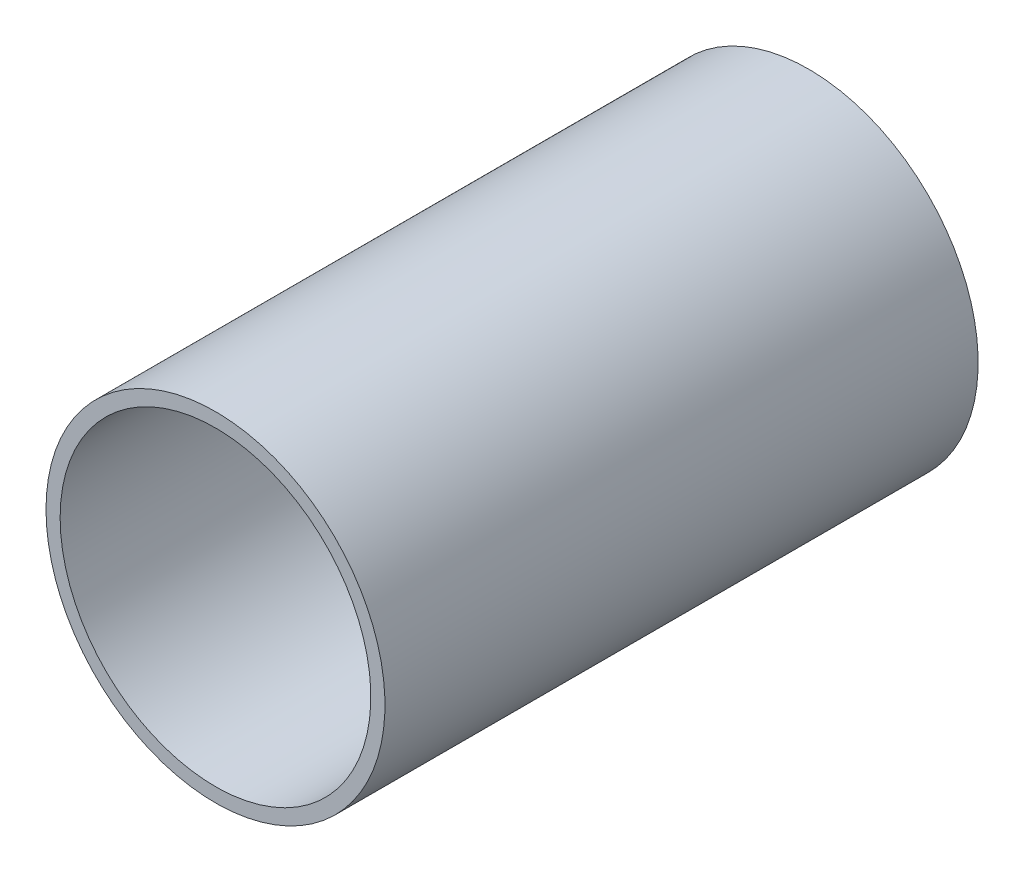
from build123d import *

# Parameters (mm, degrees)
SKETCH1_R           = 12
SKETCH1_R_2         = 11
BOSS_EXTRUDE1_DEPTH = 42


with BuildPart() as part:
    # Sketch1 → Boss-Extrude1 (new body)
    with BuildSketch(Plane.XY):
        with Locations(Location((0, 0, 0), (0, 0, 180))):
            Circle(SKETCH1_R)
        with Locations(Location((0, 0, 0), (0, 0, 180))):
            Circle(SKETCH1_R_2, mode=Mode.SUBTRACT)
    extrude(amount=BOSS_EXTRUDE1_DEPTH)


solid = part.part
